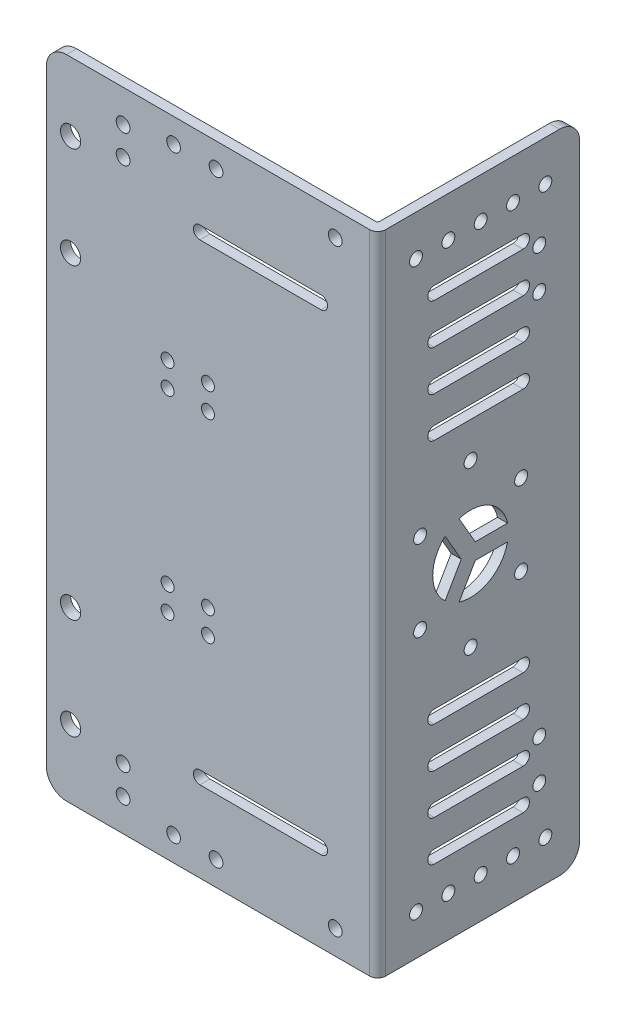
from build123d import *

# Parameters (mm, degrees)
SKETCH_1_W                  = 82
SKETCH_1_H                  = 160
EXTRUDE_1_DEPTH             = 50
SKETCH_2_W                  = 79.5
SKETCH_2_H                  = 47.5
CUT_EXTRUDE_1_DEPTH         = 187.611896727
CUT_EXTRUDE_6_DEPTH         = 186.95765647
CUT_EXTRUDE_9_DEPTH         = 187.611896727
CUT_EXTRUDE_10_DEPTH        = 187.611896727
CUT_EXTRUDE_11_DEPTH        = 187.611896727
CUT_EXTRUDE_12_DEPTH        = 187.611896727
CUT_EXTRUDE_13_DEPTH        = 187.611896727
CUT_EXTRUDE_14_DEPTH        = 187.611896727
CUT_EXTRUDE_15_DEPTH        = 187.611896727
CUT_EXTRUDE_16_DEPTH        = 187.611896727
CUT_EXTRUDE_17_DEPTH        = 187.611896727
CUT_EXTRUDE_18_DEPTH        = 187.611896727
CUT_EXTRUDE_19_DEPTH        = 187.611896727
CUT_EXTRUDE_20_DEPTH        = 187.611896727
HOLE_WIZARD_3_4_3_4_1_D     = 3.4
HOLE_WIZARD_3_4_3_4_1_DEPTH = 50
HOLE_WIZARD_3_2_3_2_2_D     = 3.2
HOLE_WIZARD_3_2_3_2_2_DEPTH = 82
HOLE_WIZARD_5_0_5_1_D       = 5
HOLE_WIZARD_5_0_5_1_DEPTH   = 50
FILLET_1_R                  = 0.5
FILLET_2_R                  = 2
FILLET_3_R                  = 5
SKETCH_30_R                 = 1.6
CUT_EXTRUDE_21_DEPTH        = 10
SKETCH_31_R                 = 1.6
CUT_EXTRUDE_22_DEPTH        = 186.52695222


with BuildPart() as part:
    # 草图1 → 凸台-拉伸1 (new body)
    with BuildSketch(Plane(origin=(0, 0, -50), x_dir=(-1, 0, 0), z_dir=(0, 0, -1))):
        with Locations((-41, 80)):
            Rectangle(SKETCH_1_W, SKETCH_1_H)
    extrude(amount=-EXTRUDE_1_DEPTH)

    # 草图2 → 切除-拉伸1 (cut, through all)
    with BuildSketch(Plane(origin=(0, 160, 0), x_dir=(-1, 0, 0), z_dir=(0, 1, 0))):
        with Locations((-39.75, -26.25)):
            Rectangle(SKETCH_2_W, SKETCH_2_H)
    extrude(amount=-CUT_EXTRUDE_1_DEPTH, mode=Mode.SUBTRACT)

    # 草图7 → 切除-拉伸6 (cut, through all)
    with BuildSketch(Plane(origin=(0, 0, -2.5), x_dir=(-1, 0, 0), z_dir=(0, 0, -1))):
        with BuildLine():
            Line((-68, 20), (-38, 20))
            ThreePointArc((-38, 20), (-36.4, 21.6), (-38, 23.2))
            Line((-38, 23.2), (-68, 23.2))
            ThreePointArc((-68, 23.2), (-69.6, 21.6), (-68, 20))
        make_face()
    extrude(amount=-CUT_EXTRUDE_6_DEPTH, mode=Mode.SUBTRACT)

    # 草图10 → 切除-拉伸9 (cut, through all)
    with BuildSketch(Plane(origin=(82, 0, 0), x_dir=(0, 0, -1), z_dir=(1, 0, 0))):
        with BuildLine():
            Line((20.690598923, 80), (16.690598923, 86.92820323))
            ThreePointArc((16.690598923, 86.92820323), (13.629378785, 80), (16.690598923, 73.07179677))
            Line((16.690598923, 73.07179677), (20.690598923, 80))
        make_face()
    extrude(amount=-CUT_EXTRUDE_9_DEPTH, mode=Mode.SUBTRACT)

    # 草图11 → 切除-拉伸10 (cut, through all)
    with BuildSketch(Plane(origin=(82, 0, 0), x_dir=(0, 0, -1), z_dir=(1, 0, 0))):
        with BuildLine():
            Line((20.154700538, 88.92820323), (24.154700538, 82))
            Line((24.154700538, 82), (32.154700538, 82))
            ThreePointArc((32.154700538, 82), (27.685310607, 88.115196021), (20.154700538, 88.92820323))
        make_face()
    extrude(amount=-CUT_EXTRUDE_10_DEPTH, mode=Mode.SUBTRACT)

    # 草图12 → 切除-拉伸11 (cut, through all)
    with BuildSketch(Plane(origin=(82, 0, 0), x_dir=(0, 0, -1), z_dir=(1, 0, 0))):
        with BuildLine():
            Line((24.154700538, 78), (20.154700538, 71.07179677))
            ThreePointArc((20.154700538, 71.07179677), (27.685310607, 71.884803979), (32.154700538, 78))
            Line((32.154700538, 78), (24.154700538, 78))
        make_face()
    extrude(amount=-CUT_EXTRUDE_11_DEPTH, mode=Mode.SUBTRACT)

    # 草图13 → 切除-拉伸12 (cut, through all)
    with BuildSketch(Plane(origin=(82, 0, 0), x_dir=(0, 0, -1), z_dir=(1, 0, 0))):
        with BuildLine():
            Line((36, 21.2), (14, 21.2))
            ThreePointArc((14, 21.2), (12.4, 19.6), (14, 18))
            Line((14, 18), (36, 18))
            ThreePointArc((36, 18), (37.6, 19.6), (36, 21.2))
        make_face()
    extrude(amount=-CUT_EXTRUDE_12_DEPTH, mode=Mode.SUBTRACT)

    # 草图14 → 切除-拉伸13 (cut, through all)
    with BuildSketch(Plane(origin=(82, 0, 0), x_dir=(0, 0, -1), z_dir=(1, 0, 0))):
        with BuildLine():
            Line((36, 31.2), (14, 31.2))
            ThreePointArc((14, 31.2), (12.4, 29.6), (14, 28))
            Line((14, 28), (36, 28))
            ThreePointArc((36, 28), (37.6, 29.6), (36, 31.2))
        make_face()
    extrude(amount=-CUT_EXTRUDE_13_DEPTH, mode=Mode.SUBTRACT)

    # 草图15 → 切除-拉伸14 (cut, through all)
    with BuildSketch(Plane(origin=(82, 0, 0), x_dir=(0, 0, -1), z_dir=(1, 0, 0))):
        with BuildLine():
            Line((36, 41.2), (14, 41.2))
            ThreePointArc((14, 41.2), (12.4, 39.6), (14, 38))
            Line((14, 38), (36, 38))
            ThreePointArc((36, 38), (37.6, 39.6), (36, 41.2))
        make_face()
    extrude(amount=-CUT_EXTRUDE_14_DEPTH, mode=Mode.SUBTRACT)

    # 草图16 → 切除-拉伸15 (cut, through all)
    with BuildSketch(Plane(origin=(82, 0, 0), x_dir=(0, 0, -1), z_dir=(1, 0, 0))):
        with BuildLine():
            Line((36, 51.2), (14, 51.2))
            ThreePointArc((14, 51.2), (12.4, 49.6), (14, 48))
            Line((14, 48), (36, 48))
            ThreePointArc((36, 48), (37.6, 49.6), (36, 51.2))
        make_face()
    extrude(amount=-CUT_EXTRUDE_15_DEPTH, mode=Mode.SUBTRACT)

    # 草图17 → 切除-拉伸16 (cut, through all)
    with BuildSketch(Plane(origin=(82, 0, 0), x_dir=(0, 0, -1), z_dir=(1, 0, 0))):
        with BuildLine():
            Line((36, 112), (14, 112))
            ThreePointArc((14, 112), (12.4, 110.4), (14, 108.8))
            Line((14, 108.8), (36, 108.8))
            ThreePointArc((36, 108.8), (37.6, 110.4), (36, 112))
        make_face()
    extrude(amount=-CUT_EXTRUDE_16_DEPTH, mode=Mode.SUBTRACT)

    # 草图18 → 切除-拉伸17 (cut, through all)
    with BuildSketch(Plane(origin=(82, 0, 0), x_dir=(0, 0, -1), z_dir=(1, 0, 0))):
        with BuildLine():
            Line((36, 122), (14, 122))
            ThreePointArc((14, 122), (12.4, 120.4), (14, 118.8))
            Line((14, 118.8), (36, 118.8))
            ThreePointArc((36, 118.8), (37.6, 120.4), (36, 122))
        make_face()
    extrude(amount=-CUT_EXTRUDE_17_DEPTH, mode=Mode.SUBTRACT)

    # 草图19 → 切除-拉伸18 (cut, through all)
    with BuildSketch(Plane(origin=(82, 0, 0), x_dir=(0, 0, -1), z_dir=(1, 0, 0))):
        with BuildLine():
            Line((36, 132), (14, 132))
            ThreePointArc((14, 132), (12.4, 130.4), (14, 128.8))
            Line((14, 128.8), (36, 128.8))
            ThreePointArc((36, 128.8), (37.6, 130.4), (36, 132))
        make_face()
    extrude(amount=-CUT_EXTRUDE_18_DEPTH, mode=Mode.SUBTRACT)

    # 草图20 → 切除-拉伸19 (cut, through all)
    with BuildSketch(Plane(origin=(82, 0, 0), x_dir=(0, 0, -1), z_dir=(1, 0, 0))):
        with BuildLine():
            Line((36, 142), (14, 142))
            ThreePointArc((14, 142), (12.4, 140.4), (14, 138.8))
            Line((14, 138.8), (36, 138.8))
            ThreePointArc((36, 138.8), (37.6, 140.4), (36, 142))
        make_face()
    extrude(amount=-CUT_EXTRUDE_19_DEPTH, mode=Mode.SUBTRACT)

    # 草图21 → 切除-拉伸20 (cut, through all)
    with BuildSketch(Plane.XY):
        with BuildLine():
            Line((68, 140), (38, 140))
            ThreePointArc((38, 140), (36.4, 138.4), (38, 136.8))
            Line((38, 136.8), (68, 136.8))
            ThreePointArc((68, 136.8), (69.6, 138.4), (68, 140))
        make_face()
    extrude(amount=-CUT_EXTRUDE_20_DEPTH, mode=Mode.SUBTRACT)

    # Ø3.4 (3.4) 直径孔1
    with Locations(Plane.XY):
        with Locations((31.5, 154), (42, 154), (71.5, 154), (71.5, 6), (42, 6), (31.5, 6), (19, 8), (19, 15), (19, 145), (19, 152)):
            Hole(HOLE_WIZARD_3_4_3_4_1_D / 2, depth=HOLE_WIZARD_3_4_3_4_1_DEPTH)

    # Ø3.2 (3.2) 直径孔2
    with Locations(Plane(origin=(82, 0, 0), x_dir=(0, 0, -1), z_dir=(1, 0, 0))):
        with Locations((9.5, 150), (17.5, 150), (25.5, 150), (33.5, 150), (41.5, 150), (41.5, 10), (33.5, 10), (25.5, 10), (17.5, 10), (10.5, 90), (23, 100), (35.5, 90), (9.5, 10), (35.5, 70), (23, 60), (10.5, 70)):
            Hole(HOLE_WIZARD_3_2_3_2_2_D / 2, depth=HOLE_WIZARD_3_2_3_2_2_DEPTH)

    # Ø5.0 (5) 直径孔1
    with Locations(Plane.XY):
        with Locations((6, 17), (6, 42), (6, 118), (6, 143)):
            Hole(HOLE_WIZARD_5_0_5_1_D / 2, depth=HOLE_WIZARD_5_0_5_1_DEPTH)

    # 圆角1
    fillet_1_edges = [part.edges().sort_by_distance(p)[0] for p in [
        (79.5, 80, -2.5),
    ]]
    fillet(fillet_1_edges, radius=FILLET_1_R)

    # 圆角2
    fillet_2_edges = [part.edges().sort_by_distance(p)[0] for p in [
        (82, 80, 0),
    ]]
    fillet(fillet_2_edges, radius=FILLET_2_R)

    # 圆角3
    fillet_3_edges = [part.edges().sort_by_distance(p)[0] for p in [
        (80.75, 160, -50),
        (80.75, 0, -50),
        (0, 160, -1.25),
        (0, 0, -1.25),
    ]]
    fillet(fillet_3_edges, radius=FILLET_3_R)

    # 草图30 → 切除-拉伸21 (cut)
    with BuildSketch(Plane(origin=(0, 0, -2.5), x_dir=(-1, 0, 0), z_dir=(0, 0, -1))):
        with Locations((-40, 59)):
            Circle(SKETCH_30_R)
        with Locations((-40, 53)):
            Circle(SKETCH_30_R)
        with Locations((-30, 59)):
            Circle(SKETCH_30_R)
        with Locations((-30, 53)):
            Circle(SKETCH_30_R)
        with Locations((-40, 107)):
            Circle(SKETCH_30_R)
        with Locations((-30, 107)):
            Circle(SKETCH_30_R)
        with Locations((-30, 101)):
            Circle(SKETCH_30_R)
        with Locations((-40, 101)):
            Circle(SKETCH_30_R)
    extrude(amount=-CUT_EXTRUDE_21_DEPTH, mode=Mode.SUBTRACT)

    # 草图31 → 切除-拉伸22 (cut, through all)
    with BuildSketch(Plane.ZY.offset(-79.5)):
        with Locations((-40, 32.35)):
            Circle(SKETCH_31_R)
        with Locations((-40, 22.35)):
            Circle(SKETCH_31_R)
        with Locations(Location((-40, 137.65, 0), (0, 0, 180))):
            Circle(SKETCH_31_R)
        with Locations(Location((-40, 127.65, 0), (0, 0, 180))):
            Circle(SKETCH_31_R)
    extrude(amount=-CUT_EXTRUDE_22_DEPTH, mode=Mode.SUBTRACT)


solid = part.part
